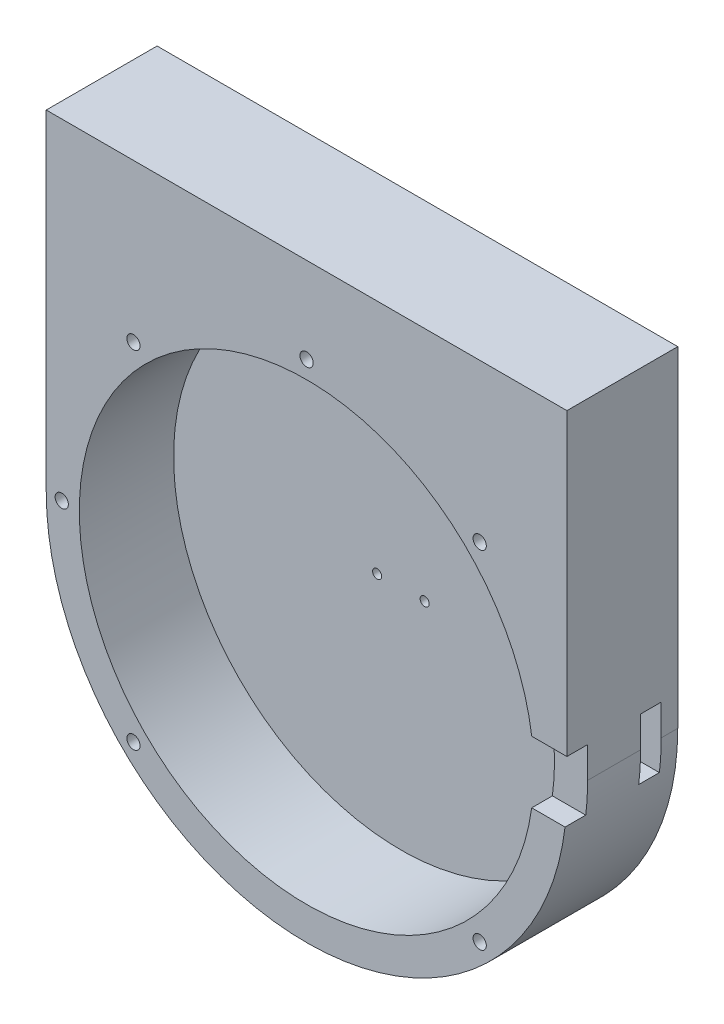
from build123d import *

# Parameters (mm, degrees)
SKETCH1_R               = 55
BOSS_EXTRUDE1_DEPTH     = 22.825
CUT_EXTRUDE1_REACH      = 152.987
CUT_EXTRUDE1_END_RADIUS = 55
SKETCH3_W               = 5
SKETCH3_H               = 15
BOSS_EXTRUDE2_START     = 4
BOSS_EXTRUDE2_DEPTH     = 4
CUT_EXTRUDE2_REACH      = 107.302
SKETCH6_R               = 1.1
CUT_EXTRUDE3_REACH      = 107.302
SKETCH7_R               = 1.6
CUT_EXTRUDE4_START      = -26.825
SKETCH7_3_R             = 1.6
CUT_EXTRUDE4_DEPTH      = 3


with BuildPart() as part:
    # Sketch1 → Boss-Extrude1 (new body)
    with BuildSketch(Plane.XY):
        with BuildLine():
            Line((-63, 80), (63, 80))
            Line((63, 80), (63, 0))
            ThreePointArc((63, 0), (0, -63), (-63, 0))
            Line((-63, 0), (-63, 80))
        make_face()
        with Locations(Location((0, 0, 0), (0, 0, 90))):
            Circle(SKETCH1_R, mode=Mode.SUBTRACT)
    extrude(amount=BOSS_EXTRUDE1_DEPTH)

    # Cut-Extrude1: up to this cylinder (the profile starts outside it)
    cut_extrude1_end = Plane(origin=(0, 0, 11.4125), z_dir=(0, 0, -1)) * Cylinder(CUT_EXTRUDE1_END_RADIUS, 434.799, mode=Mode.PRIVATE)
    # Sketch3 → Cut-Extrude1 (cut, up to the surface)
    with BuildSketch(Plane(origin=(63, 0, 0), x_dir=(0, 0, -1), z_dir=(1, 0, 0)), mode=Mode.PRIVATE) as cut_extrude1_sk1:
        with Locations((-2.5, 0)):
            Rectangle(SKETCH3_W, SKETCH3_H)
    cut_extrude1_tool1 = extrude(cut_extrude1_sk1.sketch, amount=-CUT_EXTRUDE1_REACH, mode=Mode.PRIVATE) - cut_extrude1_end
    add(cut_extrude1_tool1.solids().sort_by_distance((63, 0, 2.5))[0], mode=Mode.SUBTRACT)
    # Sketch3 → Cut-Extrude1 (cut, up to the surface)
    with BuildSketch(Plane(origin=(63, 0, 0), x_dir=(0, 0, -1), z_dir=(1, 0, 0)), mode=Mode.PRIVATE) as cut_extrude1_sk2:
        with Locations((-20.325, 0)):
            Rectangle(SKETCH3_W, SKETCH3_H)
    cut_extrude1_tool2 = extrude(cut_extrude1_sk2.sketch, amount=-CUT_EXTRUDE1_REACH, mode=Mode.PRIVATE) - cut_extrude1_end
    add(cut_extrude1_tool2.solids().sort_by_distance((63, 0, 20.325))[0], mode=Mode.SUBTRACT)

    # Sketch4 → Boss-Extrude2 (add)
    with BuildSketch(Plane(origin=(0, 0, 0), x_dir=(-1, 0, 0), z_dir=(0, 0, -1)).offset(BOSS_EXTRUDE2_START)):
        with BuildLine():
            Line((63, 0), (63, 80))
            Line((63, 80), (-63, 80))
            Line((-63, 80), (-63, 0))
            ThreePointArc((-63, 0), (0, -63), (63, 0))
        make_face()
    extrude(amount=-BOSS_EXTRUDE2_DEPTH)

    # Sketch6 → Cut-Extrude2 (cut, up to next)
    with BuildSketch(Plane(origin=(0, 0, -4), x_dir=(-1, 0, 0), z_dir=(0, 0, -1)), mode=Mode.PRIVATE) as cut_extrude2_sk1:
        with Locations((5.75, 0)):
            Circle(SKETCH6_R)
    cut_extrude2_tool1 = extrude(cut_extrude2_sk1.sketch, amount=-CUT_EXTRUDE2_REACH, mode=Mode.PRIVATE) & part.part
    # Sketch6 → Cut-Extrude2 (cut, up to next)
    with BuildSketch(Plane(origin=(0, 0, -4), x_dir=(-1, 0, 0), z_dir=(0, 0, -1)), mode=Mode.PRIVATE) as cut_extrude2_sk2:
        with Locations((-5.75, 0)):
            Circle(SKETCH6_R)
    cut_extrude2_tool2 = extrude(cut_extrude2_sk2.sketch, amount=-CUT_EXTRUDE2_REACH, mode=Mode.PRIVATE) & part.part
    add(cut_extrude2_tool1.solids().sort_by_distance((-5.75, 0, -4))[0], mode=Mode.SUBTRACT)
    add(cut_extrude2_tool2.solids().sort_by_distance((5.75, 0, -4))[0], mode=Mode.SUBTRACT)

    # Sketch7 → Cut-Extrude3 (cut, up to next)
    with BuildSketch(Plane(origin=(0, 0, -4), x_dir=(-1, 0, 0), z_dir=(0, 0, -1)), mode=Mode.PRIVATE) as cut_extrude3_sk1:
        with Locations((-41.896076785, 41.896076785)):
            Circle(SKETCH7_R)
    cut_extrude3_tool1 = extrude(cut_extrude3_sk1.sketch, amount=-CUT_EXTRUDE3_REACH, mode=Mode.PRIVATE) & part.part
    # Sketch7 → Cut-Extrude3 (cut, up to next)
    with BuildSketch(Plane(origin=(0, 0, -4), x_dir=(-1, 0, 0), z_dir=(0, 0, -1)), mode=Mode.PRIVATE) as cut_extrude3_sk2:
        with Locations((-41.896076785, -41.896076785)):
            Circle(SKETCH7_R)
    cut_extrude3_tool2 = extrude(cut_extrude3_sk2.sketch, amount=-CUT_EXTRUDE3_REACH, mode=Mode.PRIVATE) & part.part
    # Sketch7 → Cut-Extrude3 (cut, up to next)
    with BuildSketch(Plane(origin=(0, 0, -4), x_dir=(-1, 0, 0), z_dir=(0, 0, -1)), mode=Mode.PRIVATE) as cut_extrude3_sk3:
        with Locations((41.896076785, -41.896076785)):
            Circle(SKETCH7_R)
    cut_extrude3_tool3 = extrude(cut_extrude3_sk3.sketch, amount=-CUT_EXTRUDE3_REACH, mode=Mode.PRIVATE) & part.part
    # Sketch7 → Cut-Extrude3 (cut, up to next)
    with BuildSketch(Plane(origin=(0, 0, -4), x_dir=(-1, 0, 0), z_dir=(0, 0, -1)), mode=Mode.PRIVATE) as cut_extrude3_sk4:
        with Locations((41.896076785, 41.896076785)):
            Circle(SKETCH7_R)
    cut_extrude3_tool4 = extrude(cut_extrude3_sk4.sketch, amount=-CUT_EXTRUDE3_REACH, mode=Mode.PRIVATE) & part.part
    add(cut_extrude3_tool1.solids().sort_by_distance((41.896077, 41.896077, -4))[0], mode=Mode.SUBTRACT)
    add(cut_extrude3_tool2.solids().sort_by_distance((41.896077, -41.896077, -4))[0], mode=Mode.SUBTRACT)
    add(cut_extrude3_tool3.solids().sort_by_distance((-41.896077, -41.896077, -4))[0], mode=Mode.SUBTRACT)
    add(cut_extrude3_tool4.solids().sort_by_distance((-41.896077, 41.896077, -4))[0], mode=Mode.SUBTRACT)

    # Sketch7<3> → Cut-Extrude4 (cut)
    with BuildSketch(Plane(origin=(0, 0, -4), x_dir=(-1, 0, 0), z_dir=(0, 0, -1)).offset(CUT_EXTRUDE4_START)):
        with Locations(Location((59.25, 0, 0), (0, 0, 180))):
            Circle(SKETCH7_3_R)
        with Locations(Location((0, 59.25, 0), (0, 0, 180))):
            Circle(SKETCH7_3_R)
    extrude(amount=CUT_EXTRUDE4_DEPTH, mode=Mode.SUBTRACT)


solid = part.part
